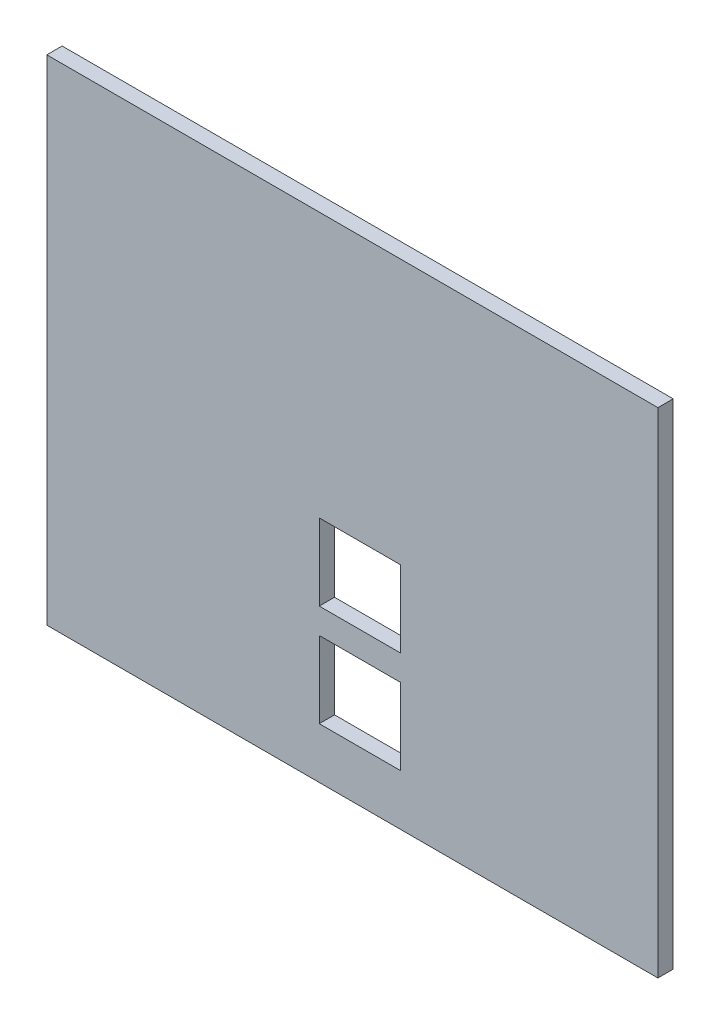
from build123d import *

# Parameters (mm, degrees)
ESBO_O1_W                = 120
ESBO_O1_H                = 97
RESSALTO_EXTRUS_O1_DEPTH = 3
ESBO_O2_W                = 16
ESBO_O2_H                = 15
CORTE_EXTRUS_O1_DEPTH    = 78.209131584
PADR_O_LINEAR1_COUNT     = 2
PADR_O_LINEAR1_PITCH     = 20


with BuildPart() as part:
    # Esboço1 → Ressalto-extrusão1 (new body)
    with BuildSketch(Plane.XY):
        Rectangle(ESBO_O1_W, ESBO_O1_H)
    extrude(amount=RESSALTO_EXTRUS_O1_DEPTH)

    # Esboço2 → Corte-extrusão1 (cut, through all)
    with BuildSketch(Plane.XY.offset(3)):
        with Locations((1.5, -31)):
            Rectangle(ESBO_O2_W, ESBO_O2_H)
    corte_extrus_o1 = extrude(amount=-CORTE_EXTRUS_O1_DEPTH, mode=Mode.SUBTRACT)

    # Padrão linear1: Corte-extrusão1 ×2
    with Locations(*[(0, i * PADR_O_LINEAR1_PITCH, 0) for i in range(1, PADR_O_LINEAR1_COUNT)]):
        add(corte_extrus_o1, mode=Mode.SUBTRACT)


solid = part.part
